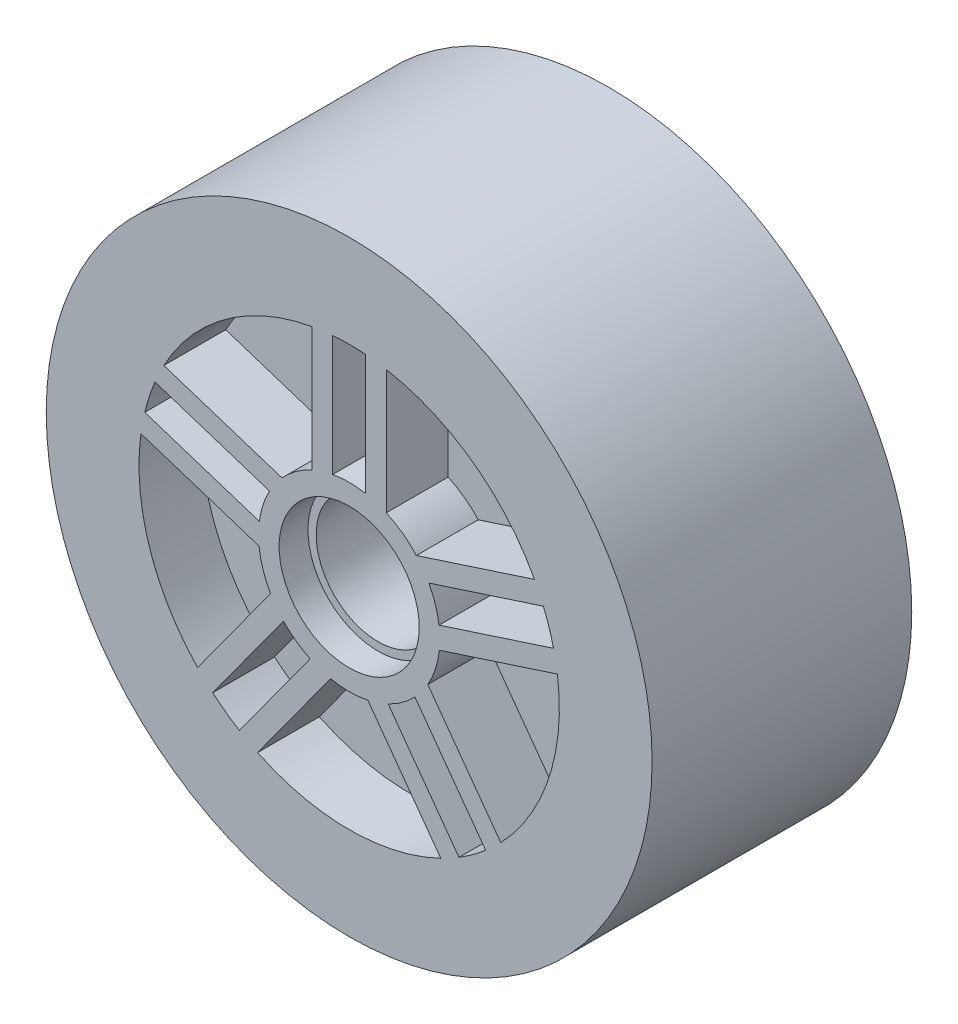
from build123d import *

# Parameters (mm, degrees)
SKETCH1_R           = 5.6
SKETCH1_R_2         = 1.5
BOSS_EXTRUDE1_DEPTH = 6.3
SKETCH2_R           = 1.7
CUT_EXTRUDE1_DEPTH  = 0.7
SKETCH3_R           = 5.1
SKETCH3_R_2         = 2.2
CUT_EXTRUDE2_DEPTH  = 1.5
BOSS_EXTRUDE2_DEPTH = 1.5
SKETCH5_R           = 4.6
SKETCH5_R_2         = 2.5
CUT_EXTRUDE3_DEPTH  = 1.5
BOSS_EXTRUDE4_START = -6.3
SKETCH6_R           = 7.35
SKETCH6_R_2         = 5.6
BOSS_EXTRUDE4_DEPTH = 6.3


with BuildPart() as part:
    # Sketch1 → Boss-Extrude1 (new body)
    with BuildSketch(Plane.XY):
        Circle(SKETCH1_R)
        Circle(SKETCH1_R_2, mode=Mode.SUBTRACT)
    extrude(amount=BOSS_EXTRUDE1_DEPTH)

    # Sketch2 → Cut-Extrude1 (cut)
    with BuildSketch(Plane.XY.offset(6.3)):
        Circle(SKETCH2_R)
    extrude(amount=-CUT_EXTRUDE1_DEPTH, mode=Mode.SUBTRACT)

    # Sketch3 → Cut-Extrude2 (cut)
    with BuildSketch(Plane.XY.offset(6.3)):
        Circle(SKETCH3_R)
        Circle(SKETCH3_R_2, mode=Mode.SUBTRACT)
    extrude(amount=-CUT_EXTRUDE2_DEPTH, mode=Mode.SUBTRACT)

    # Sketch4 → Boss-Extrude2 (add)
    with BuildSketch(Plane.XY.offset(4.8)):
        Polygon((-0.9, 2.00748599), (-0.9, 5.019960159), (-0.9, 5.084289528), (-0.4, 5.084289528), (-0.4, 2.163330765), (-0.4, 2.00748599), align=None)
        Polygon((0.4, 5.084289528), (0.4, 2.163330765), (0.4, 2.00748599), (0.9, 2.00748599), (0.9, 5.019960159), (0.9, 5.084289528), align=None)
        Polygon((1.631117337, 1.476298152), (4.496150526, 2.407203865), (4.557331391, 2.427082733), (4.711839888, 1.951554475), (1.933843023, 1.048928577), (1.785625834, 1.000769893), align=None)
        Polygon((2.03283943, 0.23992468), (2.187347927, -0.235603578), (5.052381116, 0.695302136), (5.113561981, 0.715181004), (4.959053484, 1.190709262), (2.181056619, 0.288083364), align=None)
        Polygon((1.908085954, -1.095083555), (3.678773844, -3.532226353), (3.716585698, -3.584269905), (3.3120772, -3.878162531), (1.595180717, -1.515057253), (1.503577457, -1.388976181), align=None)
        Polygon((0.856363861, -1.859204383), (0.451855364, -2.153097009), (2.222543254, -4.590239807), (2.260355108, -4.642283359), (2.664863605, -4.348390733), (0.947967122, -1.985285454), align=None)
        Polygon((-0.451855364, -2.153097009), (-2.222543254, -4.590239807), (-2.260355108, -4.642283359), (-2.664863605, -4.348390733), (-0.947967122, -1.985285454), (-0.856363861, -1.859204383), align=None)
        Polygon((-1.503577457, -1.388976181), (-1.908085954, -1.095083555), (-3.678773844, -3.532226353), (-3.716585698, -3.584269905), (-3.3120772, -3.878162531), (-1.595180717, -1.515057253), align=None)
        Polygon((-2.187347927, -0.235603578), (-5.052381116, 0.695302136), (-5.113561981, 0.715181004), (-4.959053484, 1.190709262), (-2.181056619, 0.288083364), (-2.03283943, 0.23992468), align=None)
        Polygon((-1.785625834, 1.000769893), (-1.631117337, 1.476298152), (-4.496150526, 2.407203865), (-4.557331391, 2.427082733), (-4.711839888, 1.951554475), (-1.933843023, 1.048928577), align=None)
    extrude(amount=BOSS_EXTRUDE2_DEPTH)

    # Sketch5 → Cut-Extrude3 (cut)
    with BuildSketch(Plane(origin=(0, 0, 0), x_dir=(-1, 0, 0), z_dir=(0, 0, -1))):
        Circle(SKETCH5_R)
        Circle(SKETCH5_R_2, mode=Mode.SUBTRACT)
    extrude(amount=-CUT_EXTRUDE3_DEPTH, mode=Mode.SUBTRACT)

    # Sketch6 → Boss-Extrude4 (add)
    with BuildSketch(Plane.XY.offset(6.3).offset(BOSS_EXTRUDE4_START)):
        Circle(SKETCH6_R)
        Circle(SKETCH6_R_2, mode=Mode.SUBTRACT)
    extrude(amount=BOSS_EXTRUDE4_DEPTH)


solid = part.part
